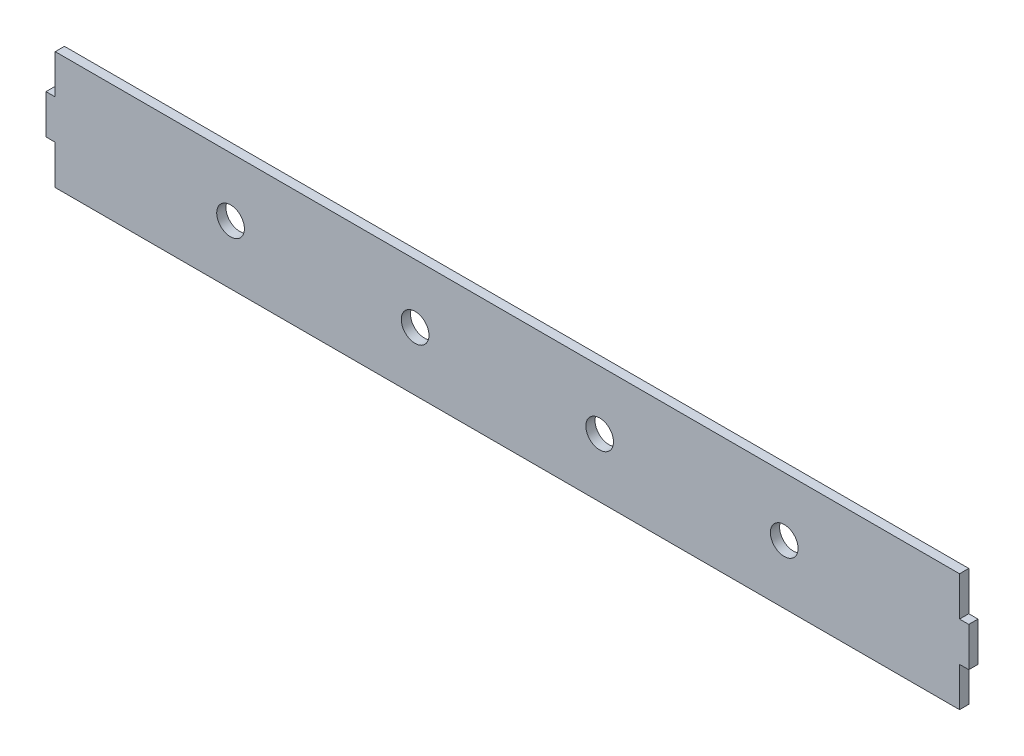
from build123d import *

# Parameters (mm, degrees)
ESQUISSE1_R        = 7.5
BOSS_EXTRU_1_DEPTH = 5


with BuildPart() as part:
    # Esquisse1 → Boss.-Extru.1 (new body)
    with BuildSketch(Plane.XY):
        Polygon((0, 0), (0, 21.266666667), (-5, 21.266666667), (-5, 42.533333333), (0, 42.533333333), (0, 63.8), (490, 63.8), (490, 42.533333333), (495, 42.533333333), (495, 21.266666667), (490, 21.266666667), (490, 0), align=None)
        with Locations((95, 31.9)):
            Circle(ESQUISSE1_R, mode=Mode.SUBTRACT)
        with Locations((195, 31.9)):
            Circle(ESQUISSE1_R, mode=Mode.SUBTRACT)
        with Locations((295, 31.9)):
            Circle(ESQUISSE1_R, mode=Mode.SUBTRACT)
        with Locations((395, 31.9)):
            Circle(ESQUISSE1_R, mode=Mode.SUBTRACT)
    extrude(amount=BOSS_EXTRU_1_DEPTH)


solid = part.part
